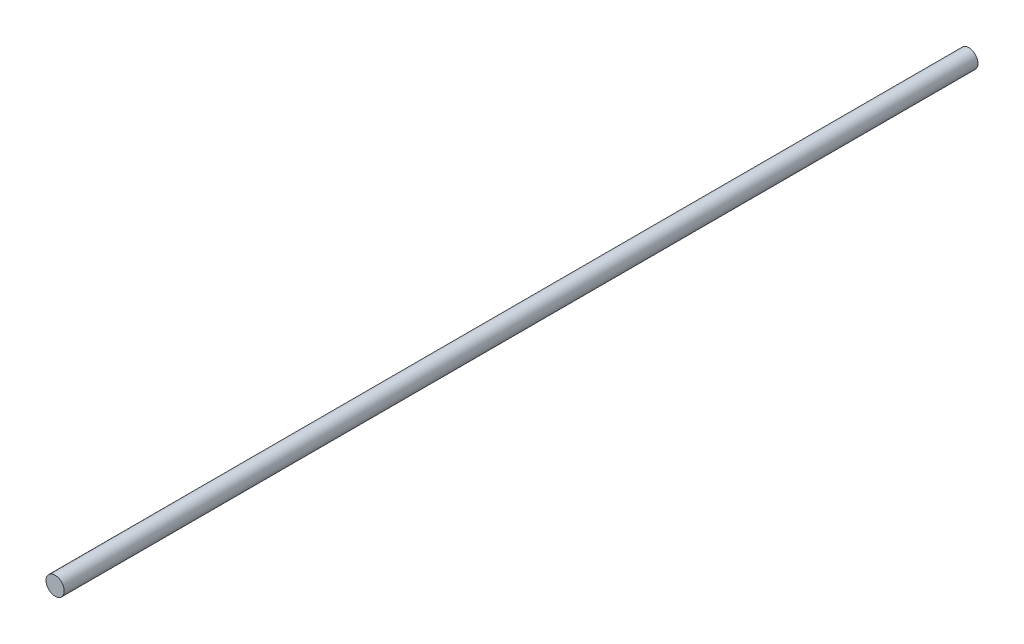
from build123d import *

# Parameters (mm, degrees)
SKIZZE1_R                       = 1.5
AUFSATZ_LINEAR_AUSTRAGEN1_DEPTH = 150


with BuildPart() as part:
    # Skizze1 → Aufsatz-Linear austragen1 (new body)
    with BuildSketch(Plane.XY):
        Circle(SKIZZE1_R)
    extrude(amount=AUFSATZ_LINEAR_AUSTRAGEN1_DEPTH)


solid = part.part
